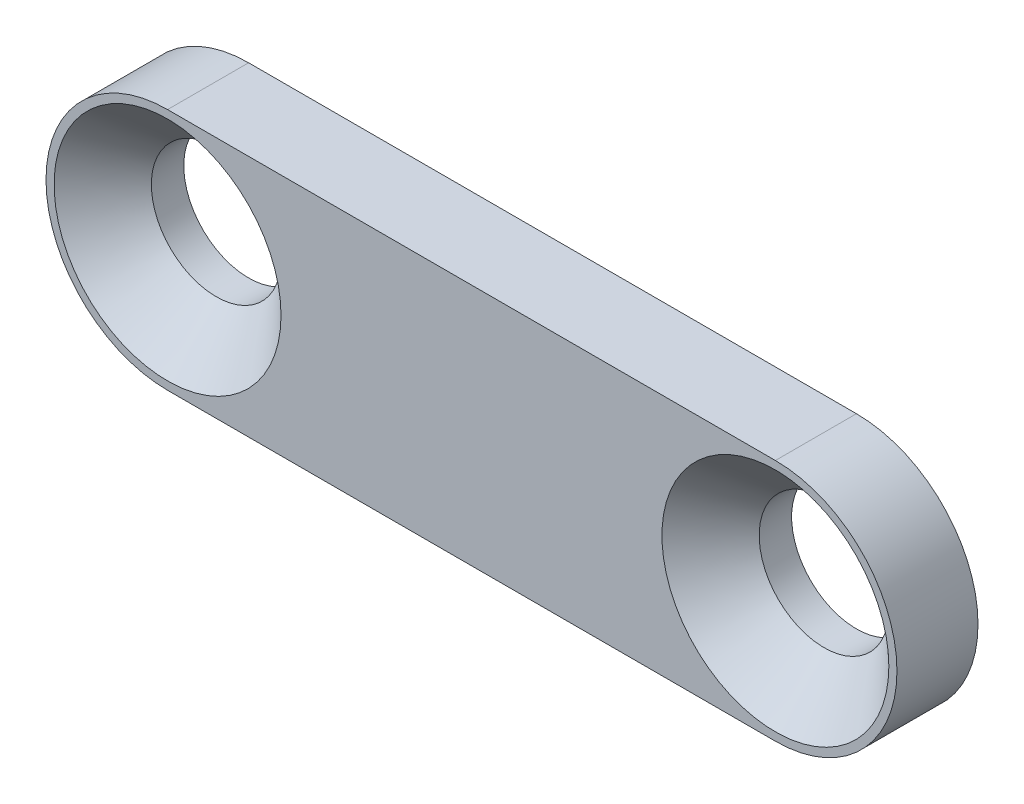
from build123d import *

# Parameters (mm, degrees)
EXTRUDE_1_DEPTH     = 2
SKETCH_2_R          = 1.6
CUT_EXTRUDE_1_DEPTH = 19.357559751
CHAMFER_1_SIZE      = 1.2


with BuildPart() as part:
    # 草图1 → 凸台-拉伸1 (new body)
    with BuildSketch(Plane.XY):
        with BuildLine():
            Line((0, -3), (-15, -3))
            ThreePointArc((-15, -3), (-18, 0), (-15, 3))
            Line((-15, 3), (0, 3))
            ThreePointArc((0, 3), (3, 0), (0, -3))
        make_face()
    extrude(amount=EXTRUDE_1_DEPTH)

    # 草图2 → 切除-拉伸1 (cut, through all)
    with BuildSketch(Plane.XY.offset(2)):
        Circle(SKETCH_2_R)
        with Locations((-15, 0)):
            Circle(SKETCH_2_R)
    extrude(amount=-CUT_EXTRUDE_1_DEPTH, mode=Mode.SUBTRACT)

    # 倒角1
    chamfer_1_edges = [part.edges().sort_by_distance(p)[0] for p in [
        (-1.6, 0, 2),
        (-16.6, 0, 2),
    ]]
    chamfer(chamfer_1_edges, length=CHAMFER_1_SIZE)


solid = part.part
